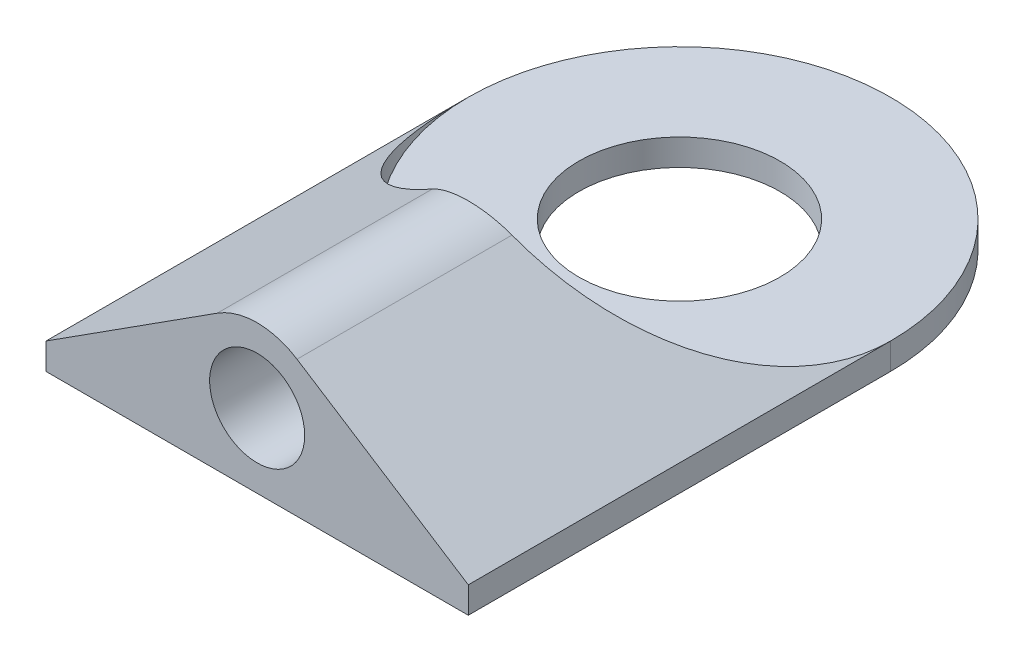
from build123d import *

# Parameters (mm, degrees)
SKETCH1_R                                     = 19.05
PISTON_CONNECTION_PLATE_DEPTH                 = 5
SKETCH2_R                                     = 9
PLATFORM_TUBE_LINK_DEPTH                      = 80
ROD_START                                     = -50
SKETCH5_R                                     = 9
ROD_CAP_PREVENT_ROD_FROM_REACHING_PISTO_DEPTH = 50
CLEANUP_CUT_1_DEPTH                           = 94.722996111
CLEANUP_CUT_1_DEPTH_BACK                      = 94.722996111
SKETCH3_R                                     = 19.05
SKETCH4_R                                     = 40
CLEANUP_CUT_2_DEPTH                           = 93.352585349


with BuildPart() as part:
    # Sketch1 → Piston connection plate (new body)
    with BuildSketch(Plane(origin=(0, 0, 0), x_dir=(1, 0, 0), z_dir=(0, 1, 0))):
        with BuildLine():
            Line((-40, 0), (-40, -80))
            Line((-40, -80), (40, -80))
            Line((40, -80), (40, 0))
            ThreePointArc((40, 0), (0, 40), (-40, 0))
        make_face()
        with Locations(Location((0, 0, 0), (0, 0, 270))):
            Circle(SKETCH1_R, mode=Mode.SUBTRACT)
    extrude(amount=PISTON_CONNECTION_PLATE_DEPTH)

    # Sketch2 → Platform tube link (add)
    with BuildSketch(Plane.XY.offset(80)):
        with BuildLine():
            Line((-40, 5), (-7.552348551, 25.788215784))
            ThreePointArc((-7.552348551, 25.788215784), (0, 28), (7.552348551, 25.788215784))
            Line((7.552348551, 25.788215784), (40, 5))
            Line((40, 5), (40, 0))
            Line((40, 0), (-40, 0))
            Line((-40, 0), (-40, 5))
        make_face()
        with Locations((0, 14)):
            Circle(SKETCH2_R, mode=Mode.SUBTRACT)
    extrude(amount=-PLATFORM_TUBE_LINK_DEPTH)

    # Sketch5 → Rod cap (prevent rod from reaching piston) (add)
    with BuildSketch(Plane(origin=(0, 0, 0), x_dir=(-1, 0, 0), z_dir=(0, 0, -1)).offset(ROD_START)):
        with Locations(Location((0, 14, 0), (0, 0, 180))):
            Circle(SKETCH5_R)
    extrude(amount=ROD_CAP_PREVENT_ROD_FROM_REACHING_PISTO_DEPTH)

    # Sketch3 → Cleanup cut 1 (cut, two sides: drawn at the far end of the back side and taken through both)
    with BuildSketch(Plane.XZ.offset(-CLEANUP_CUT_1_DEPTH_BACK)):
        Circle(SKETCH3_R)
    extrude(amount=CLEANUP_CUT_1_DEPTH + CLEANUP_CUT_1_DEPTH_BACK, mode=Mode.SUBTRACT)

    # Sketch4 → Cleanup cut 2 (cut, through all)
    with BuildSketch(Plane(origin=(0, 5, 0), x_dir=(1, 0, 0), z_dir=(0, 1, 0))):
        Circle(SKETCH4_R)
    extrude(amount=CLEANUP_CUT_2_DEPTH, mode=Mode.SUBTRACT)


solid = part.part
